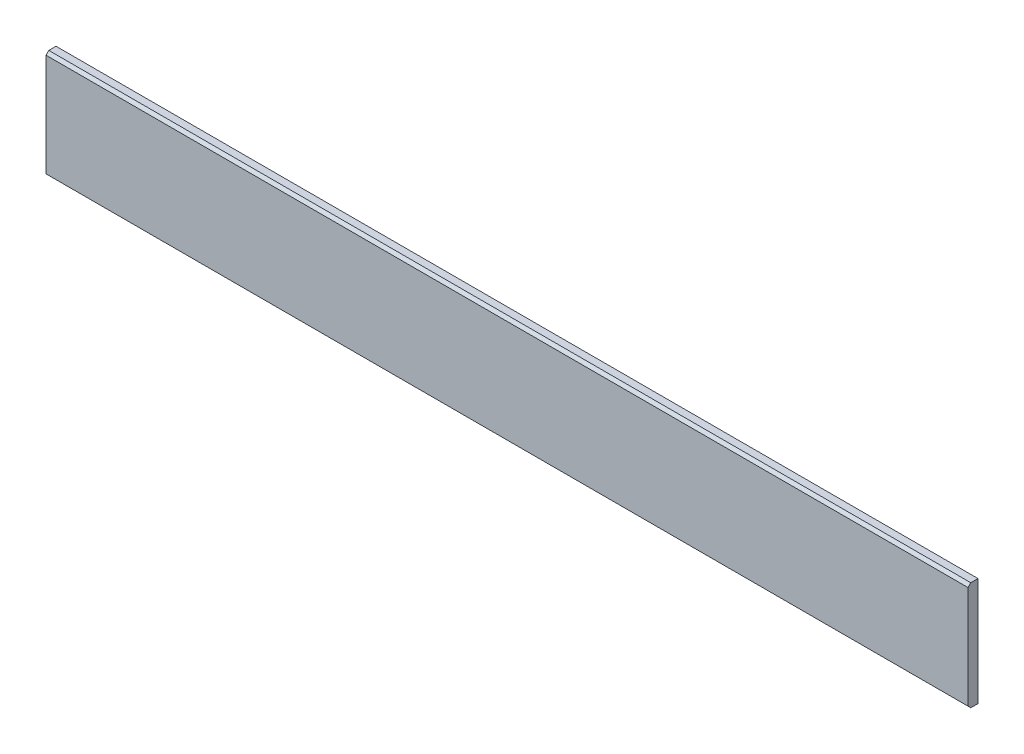
from build123d import *

# Parameters (mm, degrees)
SKETCH_1_W      = 1660
SKETCH_1_H      = 195
EXTRUDE_1_DEPTH = 18
CHAMFER_1_SIZE  = 5


with BuildPart() as part:
    # 草图1 → 凸台-拉伸1 (new body)
    with BuildSketch(Plane.XY):
        Rectangle(SKETCH_1_W, SKETCH_1_H)
    extrude(amount=EXTRUDE_1_DEPTH)

    # 倒角1
    chamfer_1_edges = [part.edges().sort_by_distance(p)[0] for p in [
        (0, -97.5, 18),
        (0, 97.5, 18),
    ]]
    chamfer(chamfer_1_edges, length=CHAMFER_1_SIZE)


solid = part.part
